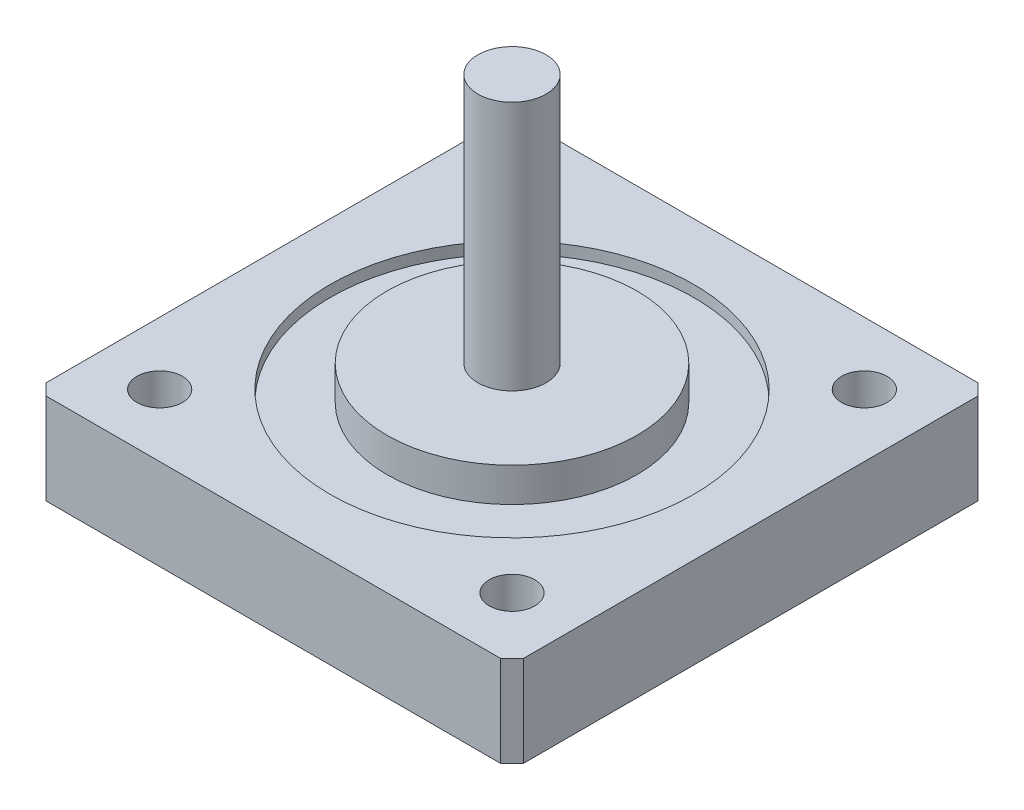
from build123d import *

# Parameters (mm, degrees)
BOSS_EXTRUDE1_DEPTH = 8
SKETCH2_R           = 16
SKETCH2_R_2         = 11
CUT_EXTRUDE1_DEPTH  = 1
SKETCH3_R           = 3
BOSS_EXTRUDE2_DEPTH = 10
SKETCH4_R           = 2
CUT_EXTRUDE2_DEPTH  = 32.336879232
BOSS_EXTRUDE4_START = 2
SKETCH5_R           = 11
BOSS_EXTRUDE4_DEPTH = 2
SKETCH6_R           = 3
BOSS_EXTRUDE5_DEPTH = 14


with BuildPart() as part:
    # Sketch1 → Boss-Extrude1 (new body)
    with BuildSketch(Plane(origin=(0, 0, 0), x_dir=(1, 0, 0), z_dir=(0, 1, 0))):
        Polygon((-21, 20), (-20, 21), (20, 21), (21, 20), (21, -20), (20, -21), (-20, -21), (-21, -20), align=None)
    extrude(amount=BOSS_EXTRUDE1_DEPTH)

    # Sketch2 → Cut-Extrude1 (cut)
    with BuildSketch(Plane(origin=(0, 8, 0), x_dir=(1, 0, 0), z_dir=(0, 1, 0))):
        with Locations(Location((0, 0, 0), (0, 0, 270))):
            Circle(SKETCH2_R)
        with Locations(Location((0, 0, 0), (0, 0, 270))):
            Circle(SKETCH2_R_2, mode=Mode.SUBTRACT)
    extrude(amount=-CUT_EXTRUDE1_DEPTH, mode=Mode.SUBTRACT)

    # Sketch3 → Boss-Extrude2 (add)
    with BuildSketch(Plane(origin=(0, 8, 0), x_dir=(1, 0, 0), z_dir=(0, 1, 0))):
        with Locations(Location((0, 0, 0), (0, 0, 90))):
            Circle(SKETCH3_R)
    extrude(amount=BOSS_EXTRUDE2_DEPTH)

    # Sketch4 → Cut-Extrude2 (cut, through all)
    with BuildSketch(Plane(origin=(0, 8, 0), x_dir=(1, 0, 0), z_dir=(0, 1, 0))):
        with Locations(Location((-15.5, 15.5, 0), (0, 0, 270))):
            Circle(SKETCH4_R)
        with Locations(Location((15.5, 15.5, 0), (0, 0, 270))):
            Circle(SKETCH4_R)
        with Locations(Location((15.5, -15.5, 0), (0, 0, 270))):
            Circle(SKETCH4_R)
        with Locations(Location((-15.5, -15.5, 0), (0, 0, 270))):
            Circle(SKETCH4_R)
    extrude(amount=-CUT_EXTRUDE2_DEPTH, mode=Mode.SUBTRACT)

    # Sketch5 → Boss-Extrude4 (add)
    with BuildSketch(Plane(origin=(0, 8, 0), x_dir=(1, 0, 0), z_dir=(0, 1, 0)).offset(BOSS_EXTRUDE4_START)):
        with Locations(Location((0, 0, 0), (0, 0, 270))):
            Circle(SKETCH5_R)
    extrude(amount=-BOSS_EXTRUDE4_DEPTH)

    # Sketch6 → Boss-Extrude5 (add)
    with BuildSketch(Plane(origin=(0, 18, 0), x_dir=(1, 0, 0), z_dir=(0, 1, 0))):
        with Locations(Location((0, 0, 0), (0, 0, 270))):
            Circle(SKETCH6_R)
    extrude(amount=BOSS_EXTRUDE5_DEPTH)


solid = part.part
